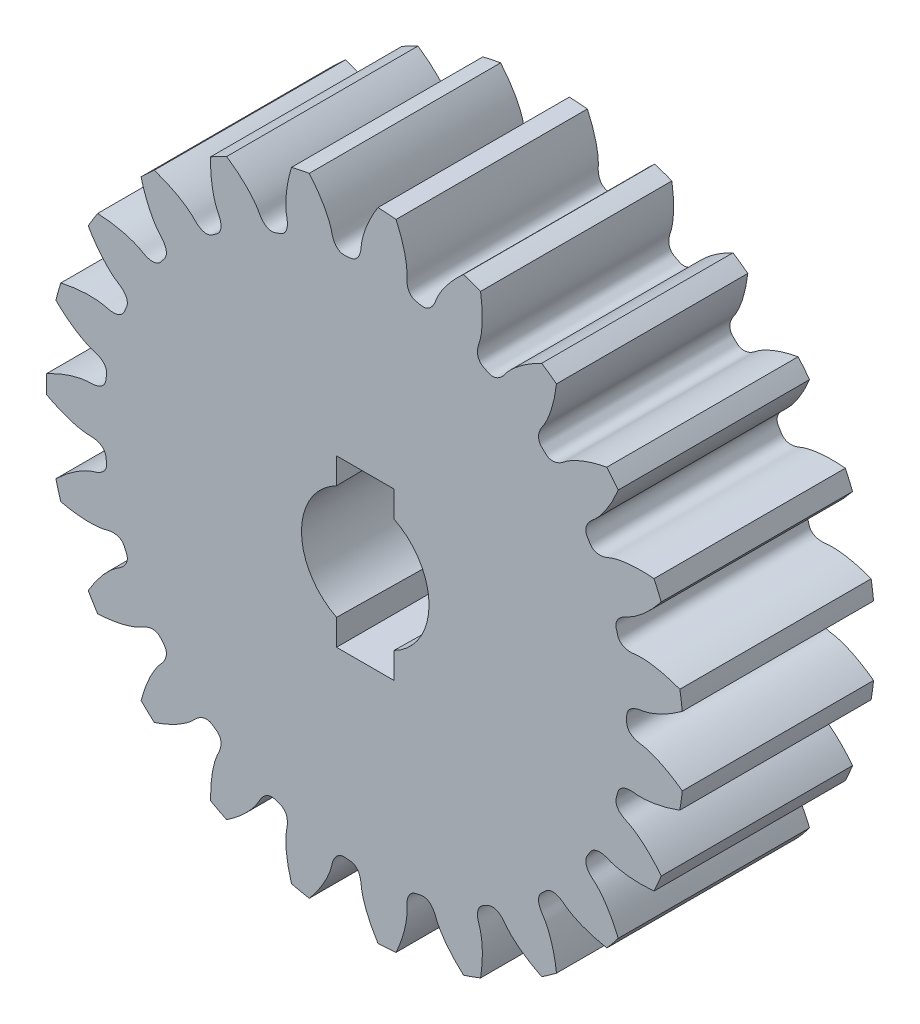
from build123d import *

# Parameters (mm, degrees)
SKETCH_305_W               = 15
SKETCH_305_H               = 24.999999625
CUT_EXTRUDE_516_DEPTH      = 7.5
PATTERN_CIRCULAR_566_COUNT = 23
SKETCH6_W                  = 4.5
SKETCH6_H                  = 13
EXTRUDE1_DEPTH             = 39.392806677


with BuildPart() as part:
    # Sketch 305 → Revolve 368 (revolve)
    with BuildSketch(Plane(origin=(0, 0, 0), x_dir=(0, 0, -1), z_dir=(1, 0, 0))):
        with Locations((0, 12.499999813)):
            Rectangle(SKETCH_305_W, SKETCH_305_H)
    revolve(axis=Axis((0, 0, 0), (0, 0, -1)))

    # Sketch 409 → Cut-Extrude 516 (cut, symmetric)
    with BuildSketch(Plane.XY):
        with BuildLine():
            ThreePointArc((24.946940176, 2.767698854), (25.099999623, 0), (24.946940176, -2.767698854))
            add(Edge.make_bspline(
                [(24.946940176, -2.767698854), (24.668111675, -2.55848501), (24.295379624, -2.301615739), (23.824279654, -2.018569123), (23.569584928, -1.875595064), (23.327481418, -1.748928833), (23.098695649, -1.63769558), (22.883912957, -1.540991185), (22.683776759, -1.457885257), (22.498887564, -1.387422301), (22.329801971, -1.328624233), (22.17703222, -1.280489869), (22.041044222, -1.242003828), (21.92226058, -1.212116442), (21.82104879, -1.18981143), (21.678155538, -1.162545326), (21.549004592, -1.147235644), (21.431343135, -1.12235154), (21.376862706, -1.109588596), (21.323539179, -1.095597029), (21.271311835, -1.080380427), (21.220123337, -1.063860995), (21.169908048, -1.045959652), (21.120595733, -1.026570065), (21.07211205, -1.005559501), (21.024381177, -0.982761453), (20.977329828, -0.957969232), (20.930893818, -0.930928205), (20.885028153, -0.901327782), (20.839722106, -0.868793915), (20.795020946, -0.832884054), (20.751055962, -0.793087773), (20.708083727, -0.748838285), (20.66653343, -0.699542201), (20.627056485, -0.644636671), (20.590566393, -0.583681484), (20.558243509, -0.516488832), (20.53149049, -0.443269859), (20.511759151, -0.364785412), (20.501220023, -0.287809912), (20.496648584, -0.165777276), (20.502542758, 0), (20.496648584, 0.165777276), (20.501220023, 0.287809912), (20.511759151, 0.364785412), (20.53149049, 0.443269859), (20.558243509, 0.516488832), (20.590566393, 0.583681484), (20.627056485, 0.644636671), (20.66653343, 0.699542201), (20.708083727, 0.748838285), (20.751055962, 0.793087773), (20.795020946, 0.832884054), (20.839722106, 0.868793915), (20.885028153, 0.901327782), (20.930893818, 0.930928205), (20.977329828, 0.957969232), (21.024381177, 0.982761453), (21.07211205, 1.005559501), (21.120595733, 1.026570065), (21.169908048, 1.045959652), (21.220123337, 1.063860995), (21.271311835, 1.080380427), (21.323539179, 1.095597029), (21.376862706, 1.109588596), (21.431343135, 1.12235154), (21.549004592, 1.147235644), (21.678155538, 1.162545326), (21.82104879, 1.18981143), (21.92226058, 1.212116442), (22.041044222, 1.242003828), (22.17703222, 1.280489869), (22.329801971, 1.328624233), (22.498887564, 1.387422301), (22.683776759, 1.457885257), (22.883912957, 1.540991185), (23.098695649, 1.63769558), (23.327481418, 1.748928833), (23.569584928, 1.875595064), (23.824279654, 2.018569123), (24.295379624, 2.301615739), (24.668111675, 2.55848501), (24.946940176, 2.767698854)],
                knots=[0, 0, 0, 0, 0.094201438, 0.122209359, 0.148519829, 0.17313285, 0.196048422, 0.217266543, 0.236787215, 0.254610438, 0.27073621, 0.285164533, 0.297895407, 0.308928831, 0.318264805, 0.32590333, 0.348240311, 0.353361839, 0.358400064, 0.363363017, 0.368259858, 0.373101054, 0.377898592, 0.38266622, 0.387419715, 0.392177188, 0.396959392, 0.401790036, 0.406696047, 0.411707719, 0.416858636, 0.422185193, 0.427725485, 0.433517261, 0.439594604, 0.44598316, 0.452694046, 0.459717233, 0.467016123, 0.474525663, 0.480668207, 0.5, 0.519331793, 0.525474337, 0.532983877, 0.540282767, 0.547305954, 0.55401684, 0.560405396, 0.566482739, 0.572274515, 0.577814807, 0.583141364, 0.588292281, 0.593303953, 0.598209964, 0.603040608, 0.607822812, 0.612580285, 0.61733378, 0.622101408, 0.626898946, 0.631740142, 0.636636983, 0.641599936, 0.646638161, 0.651759689, 0.67409667, 0.681735195, 0.691071169, 0.702104593, 0.714835467, 0.72926379, 0.745389562, 0.763212785, 0.782733457, 0.803951578, 0.82686715, 0.851480171, 0.877790641, 0.905798562, 1, 1, 1, 1], degree=3))
        make_face()
    cut_extrude_516 = extrude(amount=CUT_EXTRUDE_516_DEPTH, both=True, mode=Mode.SUBTRACT)

    # Pattern Circular 566: Cut-Extrude 516 ×23 about axis
    pattern_circular_566_axis = Axis((0, 0, 55), (0, 0, -1))
    for i in range(1, PATTERN_CIRCULAR_566_COUNT):
        add(cut_extrude_516.rotate(pattern_circular_566_axis, i * 360 / PATTERN_CIRCULAR_566_COUNT), mode=Mode.SUBTRACT)

    # Sketch 601 → Cut-Revolve 662 (revolve, cut)
    with BuildSketch(Plane(origin=(0, 0, 0), x_dir=(0, 0, -1), z_dir=(1, 0, 0))):
        Polygon((-7.5, 0), (7.5, 0), (7.5, 5.2), (-7.5, 5), align=None)
    revolve(axis=Axis((0, 0, 0), (0, 0, -1)), mode=Mode.SUBTRACT)

    # Sketch6 → Extrude1 (cut, through all)
    with BuildSketch(Plane.XY.offset(7.5)):
        Rectangle(SKETCH6_W, SKETCH6_H)
    extrude(amount=-EXTRUDE1_DEPTH, mode=Mode.SUBTRACT)


solid = part.part
